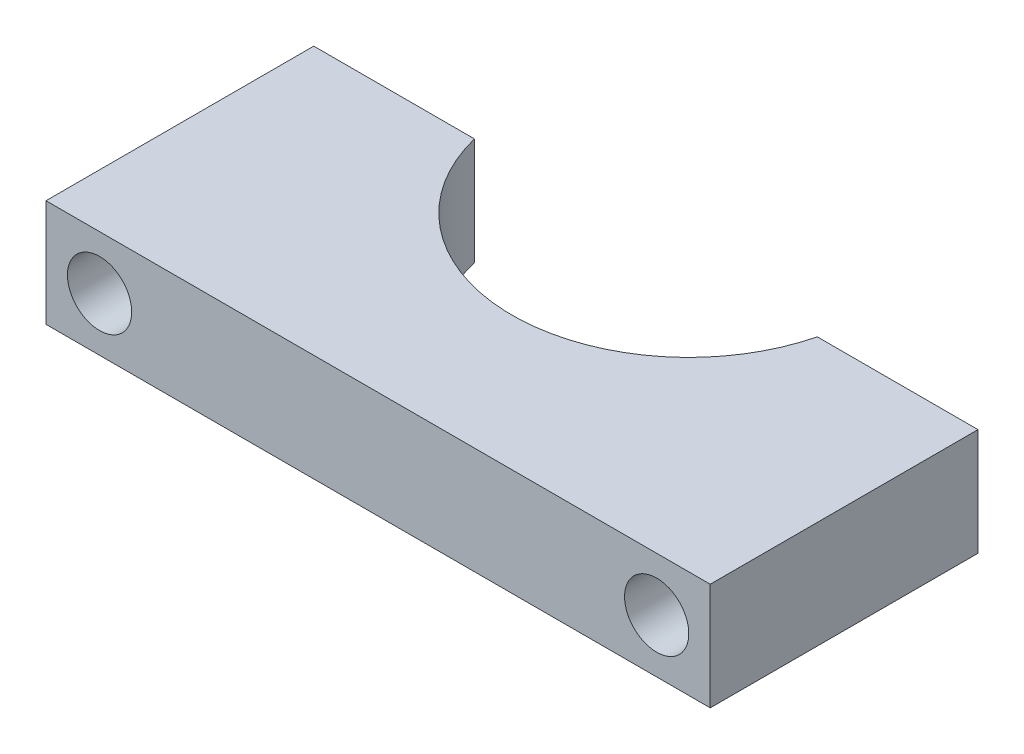
from build123d import *

# Parameters (mm, degrees)
BOSS_EXTRUDE1_DEPTH = 10
SKETCH2_R           = 3
CUT_EXTRUDE1_DEPTH  = 27


with BuildPart() as part:
    # Sketch1 → Boss-Extrude1 (new body)
    with BuildSketch(Plane(origin=(0, 0, 0), x_dir=(1, 0, 0), z_dir=(0, 1, 0))):
        with BuildLine():
            Line((-16.007810594, -4), (-31.007810594, -4))
            Line((-31.007810594, -4), (-31.007810594, -29))
            Line((-31.007810594, -29), (-22, -29))
            Line((-22, -29), (22, -29))
            Line((22, -29), (31.007810594, -29))
            Line((31.007810594, -29), (31.007810594, -4))
            Line((31.007810594, -4), (16.007810594, -4))
            ThreePointArc((16.007810594, -4), (0, -16.5), (-16.007810594, -4))
        make_face()
    extrude(amount=BOSS_EXTRUDE1_DEPTH)

    # Sketch2 → Cut-Extrude1 (cut)
    with BuildSketch(Plane(origin=(0, 0, 4), x_dir=(-1, 0, 0), z_dir=(0, 0, -1))):
        with Locations((-26.007810594, 5)):
            Circle(SKETCH2_R)
        with Locations((26.007810594, 5)):
            Circle(SKETCH2_R)
    extrude(amount=-CUT_EXTRUDE1_DEPTH, mode=Mode.SUBTRACT)


solid = part.part
